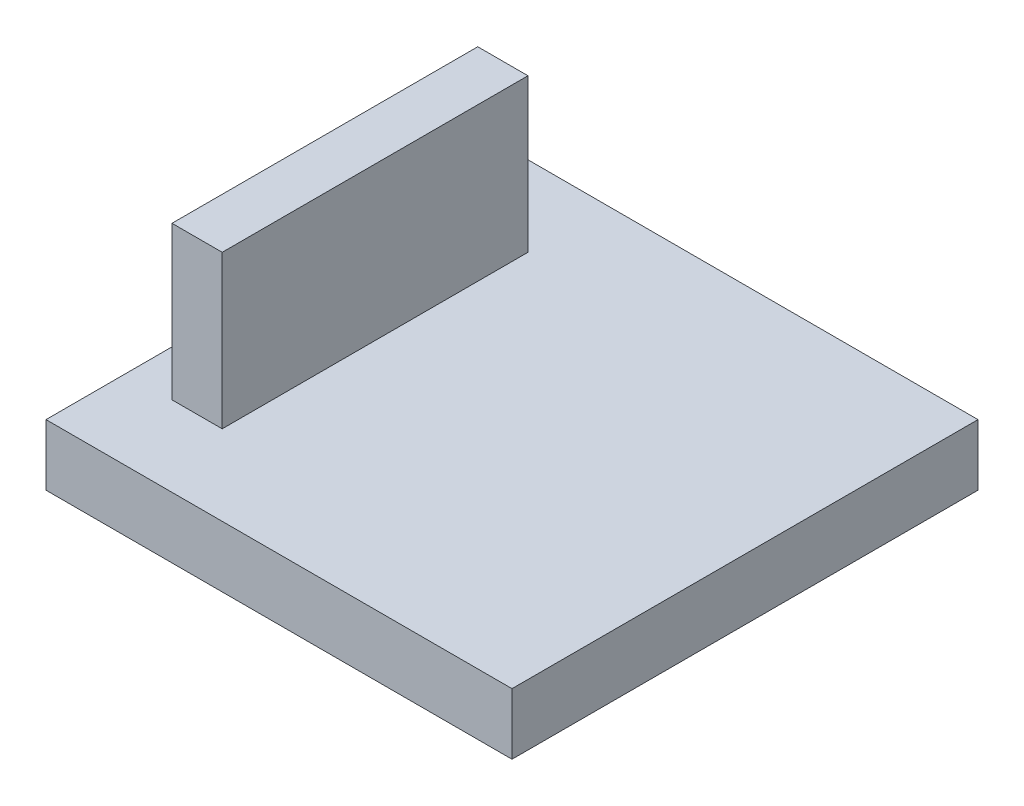
from build123d import *

# Parameters (mm, degrees)
SKETCH_1_W      = 15.24
SKETCH_1_H      = 15.24
EXTRUDE_1_DEPTH = 2
SKETCH_2_W      = 1.642626177
SKETCH_2_H      = 10
EXTRUDE_2_DEPTH = 5


with BuildPart() as part:
    # 草图1 → 凸台-拉伸1 (new body)
    with BuildSketch(Plane(origin=(0, 0, 0), x_dir=(1, 0, 0), z_dir=(0, 1, 0))):
        with Locations((7.62, 7.62)):
            Rectangle(SKETCH_1_W, SKETCH_1_H)
    extrude(amount=EXTRUDE_1_DEPTH)

    # 草图2 → 凸台-拉伸2 (add)
    with BuildSketch(Plane(origin=(0, 2, 0), x_dir=(1, 0, 0), z_dir=(0, 1, 0))):
        with Locations((2.321313089, 7.62)):
            Rectangle(SKETCH_2_W, SKETCH_2_H)
    extrude(amount=EXTRUDE_2_DEPTH)


solid = part.part
